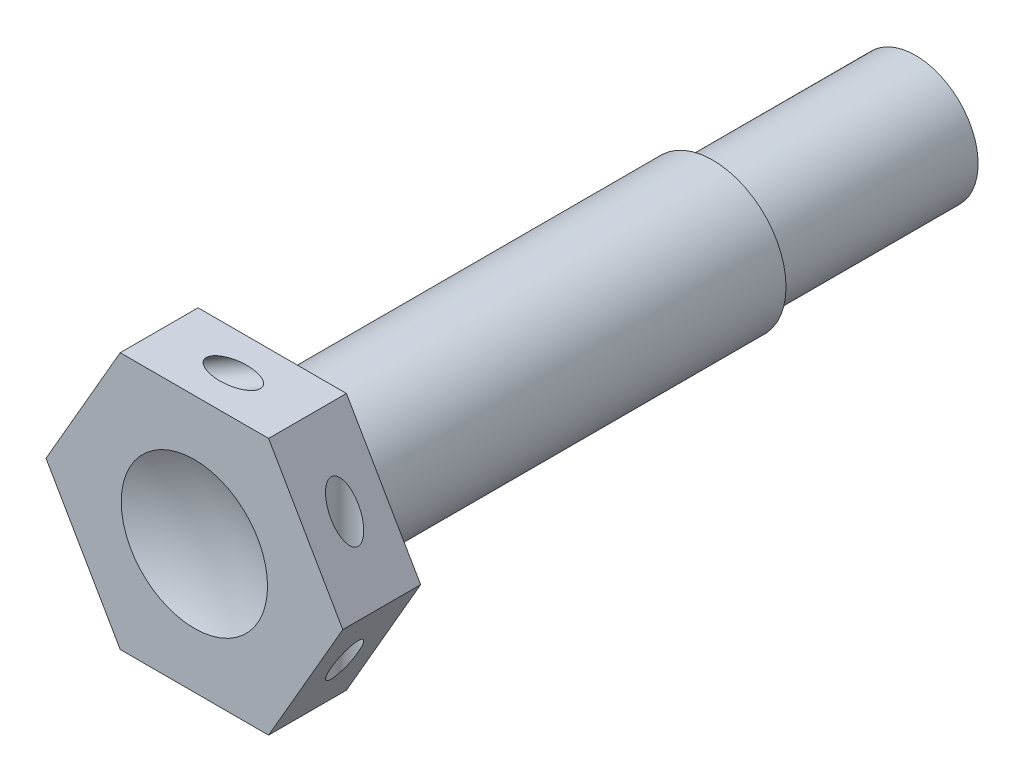
from build123d import *

# Parameters (mm, degrees)
BOSS_EXTRUDE1_DEPTH = 3.3655
SKETCH2_R           = 3.1623
BOSS_EXTRUDE2_DEPTH = 19.05
SKETCH3_R           = 2.7051
BOSS_EXTRUDE3_DEPTH = 8.763
SKETCH5_R           = 0.5842
CUT_EXTRUDE1_DEPTH  = 30.079158089
CIRPATTERN1_COUNT   = 3


with BuildPart() as part:
    # Sketch1 → Boss-Extrude1 (new body)
    with BuildSketch(Plane.XY):
        Polygon((3.207902433, 5.55625), (-3.207902433, 5.55625), (-6.415804866, 0), (-3.207902433, -5.55625), (3.207902433, -5.55625), (6.415804866, 0), align=None)
    extrude(amount=BOSS_EXTRUDE1_DEPTH)

    # Sketch2 → Boss-Extrude2 (add)
    with BuildSketch(Plane(origin=(0, 0, 0), x_dir=(-1, 0, 0), z_dir=(0, 0, -1))):
        Circle(SKETCH2_R)
    extrude(amount=BOSS_EXTRUDE2_DEPTH)

    # Sketch3 → Boss-Extrude3 (add)
    with BuildSketch(Plane(origin=(0, 0, -19.05), x_dir=(-1, 0, 0), z_dir=(0, 0, -1))):
        Circle(SKETCH3_R)
    extrude(amount=BOSS_EXTRUDE3_DEPTH)

    # Sketch4 → Cut-Revolve1 (revolve, cut)
    with BuildSketch(Plane(origin=(0, 0, 0), x_dir=(0, 0, -1), z_dir=(1, 0, 0))):
        with BuildLine():
            Line((-3.3655, 0), (-3.3655, 3.1623))
            ThreePointArc((-3.3655, 3.1623), (-2.841803396, 1.619539554), (-2.664434968, 0))
            Line((-2.664434968, 0), (-3.3655, 0))
        make_face()
    revolve(axis=Axis((0, 0, 3.3655), (0, 0, -1)), mode=Mode.SUBTRACT)

    # Sketch5 → Cut-Extrude1 (cut, symmetric)
    with BuildSketch(Plane(origin=(0, 0, 0), x_dir=(1, 0, 0), z_dir=(0, 1, 0))):
        with Locations((4.81185365, -1.68275)):
            Circle(SKETCH5_R)
    cut_extrude1 = extrude(amount=CUT_EXTRUDE1_DEPTH, both=True, mode=Mode.SUBTRACT)

    # CirPattern1: Cut-Extrude1 ×3 about axis
    cirpattern1_axis = Axis((0, 0, -29.371925), (0, 0, 1))
    for i in range(1, CIRPATTERN1_COUNT):
        add(cut_extrude1.rotate(cirpattern1_axis, i * 360 / CIRPATTERN1_COUNT), mode=Mode.SUBTRACT)


solid = part.part
